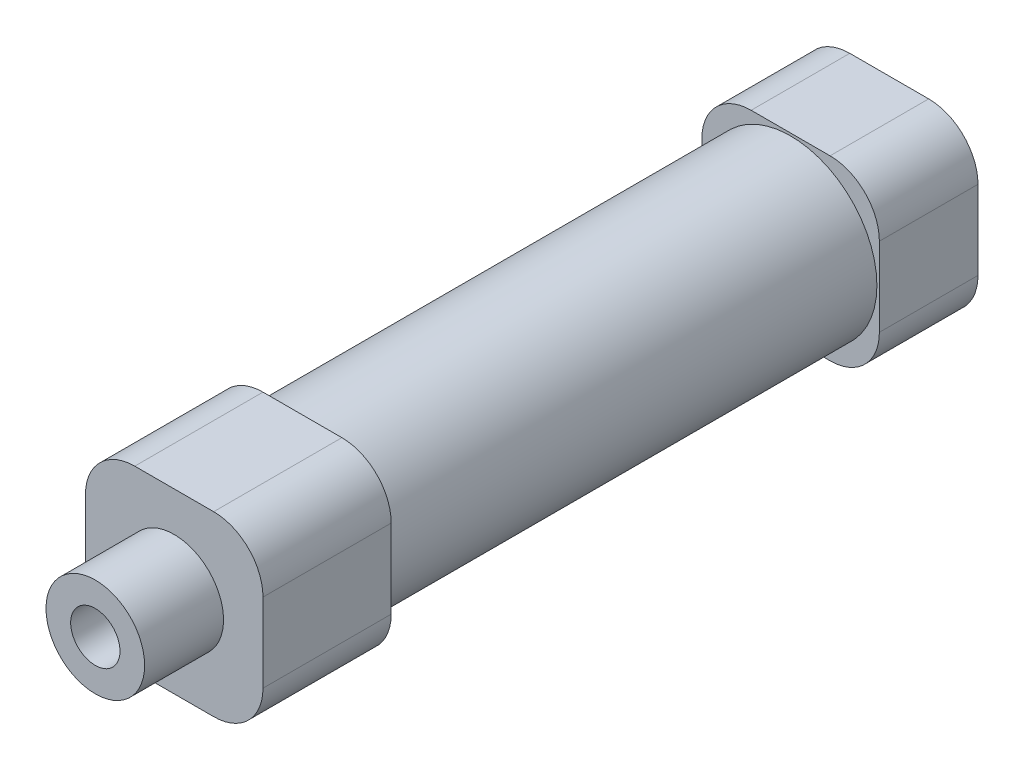
from build123d import *

# Parameters (mm, degrees)
SKETCH_1_W               = 18
SKETCH_1_H               = 18
EXTRUDE_1_DEPTH          = 10
SKETCH_2_R               = 8.75
EXTRUDE_2_DEPTH          = 49.5
SKETCH_3_W               = 18
SKETCH_3_H               = 18
EXTRUDE_3_DEPTH          = 13
SKETCH_4_R               = 5
EXTRUDE_4_DEPTH          = 8
SKETCH_5_R               = 2.5
CUT_EXTRUDE_1_DEPTH      = 79.5
FILLET_1_R               = 5
CUT_EXTRUDE_2_REACH      = 84.977
CUT_EXTRUDE_2_END_RADIUS = 2.5
SKETCH_6_R               = 2.5


with BuildPart() as part:
    # 草图1 → 凸台-拉伸1 (new body)
    with BuildSketch(Plane.XY):
        Rectangle(SKETCH_1_W, SKETCH_1_H)
    extrude(amount=EXTRUDE_1_DEPTH)

    # 草图2 → 凸台-拉伸2 (add)
    with BuildSketch(Plane.XY.offset(10)):
        Circle(SKETCH_2_R)
    extrude(amount=EXTRUDE_2_DEPTH)

    # 草图3 → 凸台-拉伸3 (add)
    with BuildSketch(Plane.XY.offset(59.5)):
        Rectangle(SKETCH_3_W, SKETCH_3_H)
    extrude(amount=EXTRUDE_3_DEPTH)

    # 草图4 → 凸台-拉伸4 (add)
    with BuildSketch(Plane.XY.offset(72.5)):
        with Locations(Location((0, 0, 0), (0, 0, 180))):
            Circle(SKETCH_4_R)
    extrude(amount=EXTRUDE_4_DEPTH)

    # 草图5 → 切除-拉伸1 (cut)
    with BuildSketch(Plane.XY.offset(80.5)):
        Circle(SKETCH_5_R)
    extrude(amount=-CUT_EXTRUDE_1_DEPTH, mode=Mode.SUBTRACT)

    # 圆角1
    fillet_1_edges = [part.edges().sort_by_distance(p)[0] for p in [
        (9, -9, 66),
        (9, 9, 66),
        (-9, 9, 66),
        (-9, -9, 66),
        (9, -9, 5),
        (-9, -9, 5),
        (-9, 9, 5),
        (9, 9, 5),
    ]]
    fillet(fillet_1_edges, radius=FILLET_1_R)

    # 切除-拉伸2: up to this cylinder (the profile starts outside it)
    cut_extrude_2_end = Plane(origin=(0, 0, 34.75), z_dir=(0, 0, 1)) * Cylinder(CUT_EXTRUDE_2_END_RADIUS, 234.954, mode=Mode.PRIVATE)
    # 草图6 → 切除-拉伸2 (cut, up to the surface)
    with BuildSketch(Plane.XZ.offset(9), mode=Mode.PRIVATE) as cut_extrude_2_sk1:
        with Locations(Location((0, 5.25, 0), (0, 0, 270))):
            Circle(SKETCH_6_R)
    cut_extrude_2_tool1 = extrude(cut_extrude_2_sk1.sketch, amount=-CUT_EXTRUDE_2_REACH, mode=Mode.PRIVATE) - cut_extrude_2_end
    add(cut_extrude_2_tool1.solids().sort_by_distance((0, -9, 5.25))[0], mode=Mode.SUBTRACT)
    # 草图6 → 切除-拉伸2 (cut, up to the surface)
    with BuildSketch(Plane.XZ.offset(9), mode=Mode.PRIVATE) as cut_extrude_2_sk2:
        with Locations(Location((0, 64.25, 0), (0, 0, 270))):
            Circle(SKETCH_6_R)
    cut_extrude_2_tool2 = extrude(cut_extrude_2_sk2.sketch, amount=-CUT_EXTRUDE_2_REACH, mode=Mode.PRIVATE) - cut_extrude_2_end
    add(cut_extrude_2_tool2.solids().sort_by_distance((0, -9, 64.25))[0], mode=Mode.SUBTRACT)


solid = part.part
